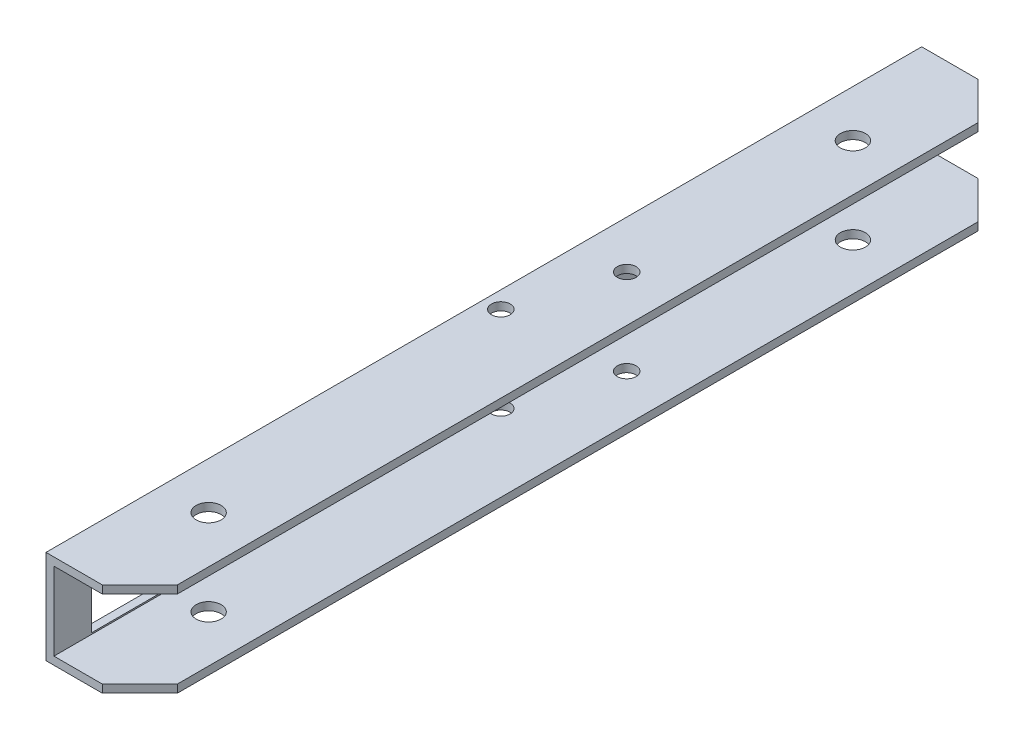
from build123d import *

# Parameters (mm, degrees)
BOSS_EXTRUDE1_DEPTH = 700
SKETCH3_W           = 125
SKETCH3_H           = 60
CUT_EXTRUDE1_DEPTH  = 706.00443261
CHAMFER1_SIZE       = 30
SKETCH4_R           = 10
CUT_EXTRUDE2_DEPTH  = 708.990112925
SKETCH5_R           = 7.5
CUT_EXTRUDE3_DEPTH  = 708.990112925
CHAMFER2_SIZE       = 3
FILLET1_R           = 3


with BuildPart() as part:
    # Sketch1 → Boss-Extrude1 (new body)
    with BuildSketch(Plane.XY):
        Polygon((0, -37.5), (0, 37.5), (75, 37.5), (75, 31.15), (6.35, 31.15), (6.35, -31.15), (75, -31.15), (75, -37.5), align=None)
    extrude(amount=BOSS_EXTRUDE1_DEPTH)

    # Sketch3 → Cut-Extrude1 (cut, through all)
    with BuildSketch(Plane.ZY):
        with Locations((92.5, 0)):
            Rectangle(SKETCH3_W, SKETCH3_H)
        with Locations((607.5, 0)):
            Rectangle(SKETCH3_W, SKETCH3_H)
        Polygon((400, 10.383333333), (373, 10.383333333), (373, 31.15), (327, 31.15), (307, 31.15), (307, 10.383333333), (300, 10.383333333), (270, 10.383333333), (270, -10.383333333), (300, -10.383333333), (327, -10.383333333), (327, -31.15), (373, -31.15), (393, -31.15), (393, -10.383333333), (400, -10.383333333), align=None)
    extrude(amount=-CUT_EXTRUDE1_DEPTH, mode=Mode.SUBTRACT)

    # Chamfer1
    chamfer1_edges = [part.edges().sort_by_distance(p)[0] for p in [
        (75, -34.325, 0),
        (75, 34.325, 700),
        (75, -34.325, 700),
        (75, 34.325, 0),
    ]]
    chamfer(chamfer1_edges, length=CHAMFER1_SIZE)

    # Sketch4 → Cut-Extrude2 (cut, through all)
    with BuildSketch(Plane(origin=(0, 37.5, 0), x_dir=(1, 0, 0), z_dir=(0, 1, 0))):
        with Locations(Location((37.5, -607.5, 0), (0, 0, 270))):
            Circle(SKETCH4_R)
        with Locations(Location((37.5, -92.5, 0), (0, 0, 270))):
            Circle(SKETCH4_R)
    extrude(amount=-CUT_EXTRUDE2_DEPTH, mode=Mode.SUBTRACT)

    # Sketch5 → Cut-Extrude3 (cut, through all)
    with BuildSketch(Plane.XZ.offset(37.5)):
        with Locations(Location((38, 273.823015652, 0), (0, 0, 270))):
            Circle(SKETCH5_R)
        with Locations(Location((13.565044391, 350, 0), (0, 0, 270))):
            Circle(SKETCH5_R)
    extrude(amount=-CUT_EXTRUDE3_DEPTH, mode=Mode.SUBTRACT)

    # Chamfer2
    chamfer2_edges = [part.edges().sort_by_distance(p)[0] for p in [
        (6.35, -20.766666667, 327),
        (6.35, 0, 270),
        (6.35, 20.766666667, 373),
        (0, -20.766666667, 393),
        (0, 20.766666667, 307),
    ]]
    chamfer(chamfer2_edges, length=CHAMFER2_SIZE)

    # Fillet1
    fillet1_edges = [part.edges().sort_by_distance(p)[0] for p in [
        (1.675, 10.383333333, 270),
        (1.675, -10.383333333, 270),
        (1.675, 31.15, 373),
        (1.675, -31.15, 327),
        (4.675, -31.15, 393),
        (4.675, 31.15, 307),
        (3.175, 10.383333333, 400),
        (3.175, -10.383333333, 400),
    ]]
    fillet(fillet1_edges, radius=FILLET1_R)


solid = part.part
